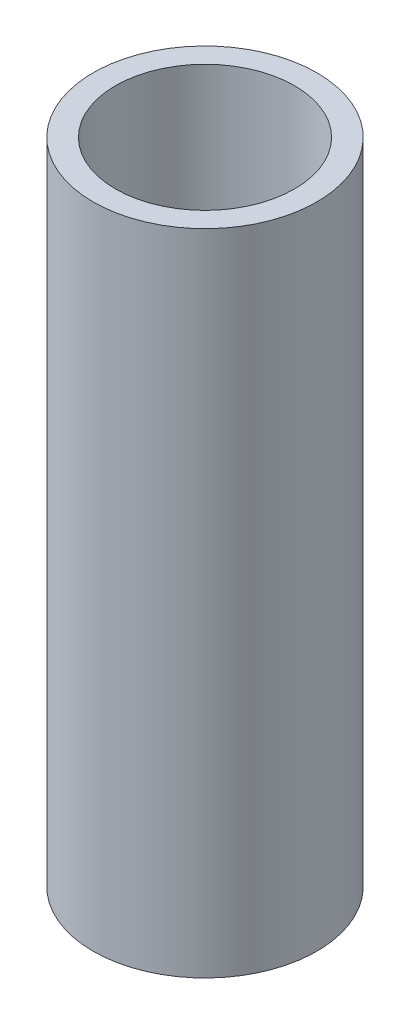
from build123d import *

# Parameters (mm, degrees)
SKETCH1_R           = 5
SKETCH1_R_2         = 4
BOSS_EXTRUDE1_DEPTH = 29


with BuildPart() as part:
    # Sketch1 → Boss-Extrude1 (new body)
    with BuildSketch(Plane(origin=(0, 0, 0), x_dir=(1, 0, 0), z_dir=(0, 1, 0))):
        with Locations(Location((0, 0, 0), (0, 0, 90))):
            Circle(SKETCH1_R)
        with Locations(Location((0, 0, 0), (0, 0, 90))):
            Circle(SKETCH1_R_2, mode=Mode.SUBTRACT)
    extrude(amount=BOSS_EXTRUDE1_DEPTH)


solid = part.part
